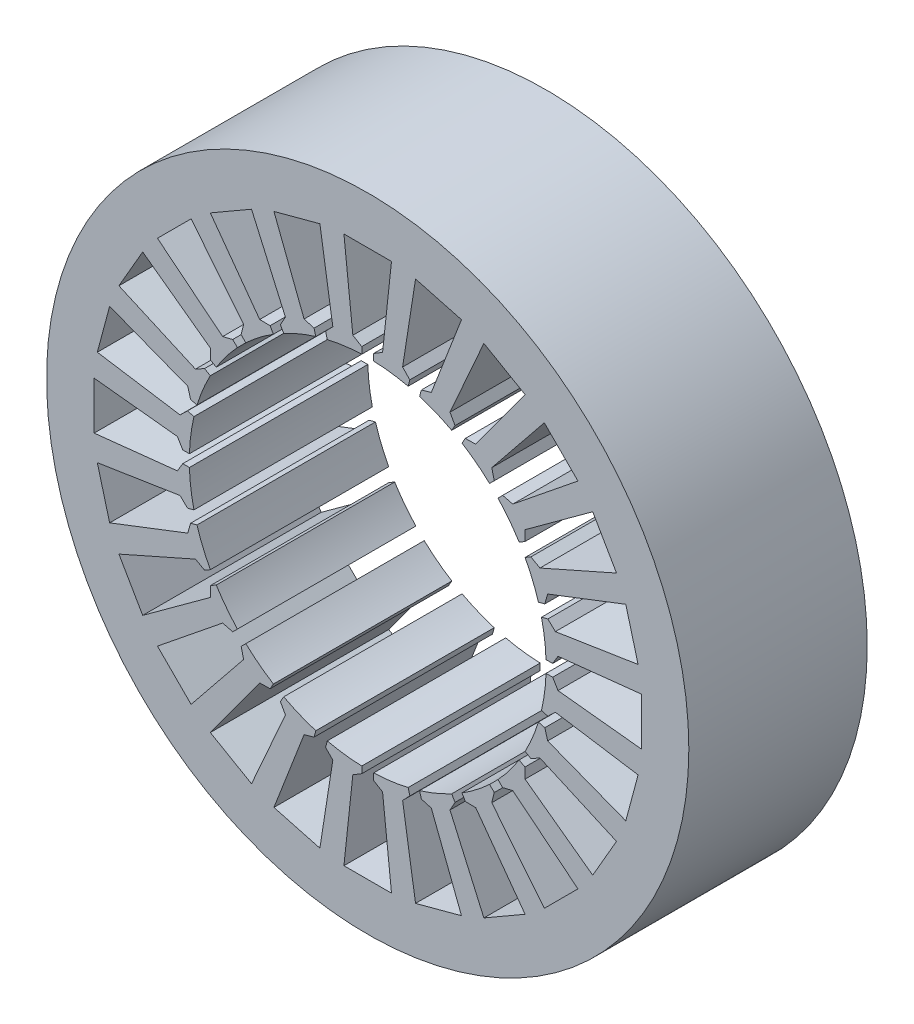
from build123d import *

# Parameters (mm, degrees)
STATOR_STACK_START = -15
SKETCH_1_R         = 54
SKETCH_1_R_2       = 30
STATOR_STACK_DEPTH = 30
STATOR_SLOTS_DEPTH = 16


with BuildPart() as part:
    # Эскиз1 → Stator_stack (new body)
    with BuildSketch(Plane.XY.offset(STATOR_STACK_START)):
        Circle(SKETCH_1_R)
        Circle(SKETCH_1_R_2, mode=Mode.SUBTRACT)
    extrude(amount=STATOR_STACK_DEPTH)

    # Эскиз2 → Stator_slots (cut, symmetric)
    with BuildSketch(Plane.XY):
        Polygon((28.982753492, -1), (31.1, -1), (32, -2.5), (39.5, -3.303571429), (46, -4), (46, 4), (39.5, 3.303571429), (32, 2.5), (31.1, 1), (28.982753492, 1), align=None)
        Polygon((28.25400916, 6.535362757), (30.299112243, 7.083346476), (31.556674054, 5.867394878), (39.009097341, 7.03234732), (45.46786419, 8.04197277), (43.397311829, 15.76937938), (37.299042936, 13.414357243), (30.262578828, 10.697024009), (29.781474152, 9.015198129), (27.73637107, 8.46721441), align=None)
        Polygon((25.599800796, 13.625351342), (27.433390058, 14.683974596), (28.962812921, 13.834936491), (35.859789164, 16.88902322), (41.837168574, 19.535898385), (37.837168574, 26.464101615), (32.556217735, 22.61097678), (26.462812921, 18.165063509), (26.433390058, 16.416025404), (24.599800796, 15.35740215), align=None)
        Polygon((21.201008313, 19.786794751), (22.698127676, 21.283914114), (24.395183951, 20.859650045), (30.266695616, 25.594740098), (35.355339059, 29.69848481), (29.69848481, 35.355339059), (25.594740098, 30.266695616), (20.859650045, 24.395183951), (21.283914114, 22.698127676), (19.786794751, 21.201008313), align=None)
        Polygon((15.35740215, 24.599800796), (16.416025404, 26.433390058), (18.165063509, 26.462812921), (22.61097678, 32.556217735), (26.464101615, 37.837168574), (19.535898385, 41.837168574), (16.88902322, 35.859789164), (13.834936491, 28.962812921), (14.683974596, 27.433390058), (13.625351342, 25.599800796), align=None)
        Polygon((8.46721441, 27.73637107), (9.015198129, 29.781474152), (10.697024009, 30.262578828), (13.414357243, 37.299042936), (15.76937938, 43.397311829), (8.04197277, 45.46786419), (7.03234732, 39.009097341), (5.867394878, 31.556674054), (7.083346476, 30.299112243), (6.535362757, 28.25400916), align=None)
        Polygon((1, 28.982753492), (1, 31.1), (2.5, 32), (3.303571429, 39.5), (4, 46), (-4, 46), (-3.303571429, 39.5), (-2.5, 32), (-1, 31.1), (-1, 28.982753492), align=None)
        Polygon((-6.535362757, 28.25400916), (-7.083346476, 30.299112243), (-5.867394878, 31.556674054), (-7.03234732, 39.009097341), (-8.04197277, 45.46786419), (-15.76937938, 43.397311829), (-13.414357243, 37.299042936), (-10.697024009, 30.262578828), (-9.015198129, 29.781474152), (-8.46721441, 27.73637107), align=None)
        Polygon((-13.625351342, 25.599800796), (-14.683974596, 27.433390058), (-13.834936491, 28.962812921), (-16.88902322, 35.859789164), (-19.535898385, 41.837168574), (-26.464101615, 37.837168574), (-22.61097678, 32.556217735), (-18.165063509, 26.462812921), (-16.416025404, 26.433390058), (-15.35740215, 24.599800796), align=None)
        Polygon((-19.786794751, 21.201008313), (-21.283914114, 22.698127676), (-20.859650045, 24.395183951), (-25.594740098, 30.266695616), (-29.69848481, 35.355339059), (-35.355339059, 29.69848481), (-30.266695616, 25.594740098), (-24.395183951, 20.859650045), (-22.698127676, 21.283914114), (-21.201008313, 19.786794751), align=None)
        Polygon((-24.599800796, 15.35740215), (-26.433390058, 16.416025404), (-26.462812921, 18.165063509), (-32.556217735, 22.61097678), (-37.837168574, 26.464101615), (-41.837168574, 19.535898385), (-35.859789164, 16.88902322), (-28.962812921, 13.834936491), (-27.433390058, 14.683974596), (-25.599800796, 13.625351342), align=None)
        Polygon((-27.73637107, 8.46721441), (-29.781474152, 9.015198129), (-30.262578828, 10.697024009), (-37.299042936, 13.414357243), (-43.397311829, 15.76937938), (-45.46786419, 8.04197277), (-39.009097341, 7.03234732), (-31.556674054, 5.867394878), (-30.299112243, 7.083346476), (-28.25400916, 6.535362757), align=None)
        Polygon((-28.982753492, 1), (-31.1, 1), (-32, 2.5), (-39.5, 3.303571429), (-46, 4), (-46, -4), (-39.5, -3.303571429), (-32, -2.5), (-31.1, -1), (-28.982753492, -1), align=None)
        Polygon((-28.25400916, -6.535362757), (-30.299112243, -7.083346476), (-31.556674054, -5.867394878), (-39.009097341, -7.03234732), (-45.46786419, -8.04197277), (-43.397311829, -15.76937938), (-37.299042936, -13.414357243), (-30.262578828, -10.697024009), (-29.781474152, -9.015198129), (-27.73637107, -8.46721441), align=None)
        Polygon((-25.599800796, -13.625351342), (-27.433390058, -14.683974596), (-28.962812921, -13.834936491), (-35.859789164, -16.88902322), (-41.837168574, -19.535898385), (-37.837168574, -26.464101615), (-32.556217735, -22.61097678), (-26.462812921, -18.165063509), (-26.433390058, -16.416025404), (-24.599800796, -15.35740215), align=None)
        Polygon((-21.201008313, -19.786794751), (-22.698127676, -21.283914114), (-24.395183951, -20.859650045), (-30.266695616, -25.594740098), (-35.355339059, -29.69848481), (-29.69848481, -35.355339059), (-25.594740098, -30.266695616), (-20.859650045, -24.395183951), (-21.283914114, -22.698127676), (-19.786794751, -21.201008313), align=None)
        Polygon((-15.35740215, -24.599800796), (-16.416025404, -26.433390058), (-18.165063509, -26.462812921), (-22.61097678, -32.556217735), (-26.464101615, -37.837168574), (-19.535898385, -41.837168574), (-16.88902322, -35.859789164), (-13.834936491, -28.962812921), (-14.683974596, -27.433390058), (-13.625351342, -25.599800796), align=None)
        Polygon((-8.46721441, -27.73637107), (-9.015198129, -29.781474152), (-10.697024009, -30.262578828), (-13.414357243, -37.299042936), (-15.76937938, -43.397311829), (-8.04197277, -45.46786419), (-7.03234732, -39.009097341), (-5.867394878, -31.556674054), (-7.083346476, -30.299112243), (-6.535362757, -28.25400916), align=None)
        Polygon((-1, -28.982753492), (-1, -31.1), (-2.5, -32), (-3.303571429, -39.5), (-4, -46), (4, -46), (3.303571429, -39.5), (2.5, -32), (1, -31.1), (1, -28.982753492), align=None)
        Polygon((6.535362757, -28.25400916), (7.083346476, -30.299112243), (5.867394878, -31.556674054), (7.03234732, -39.009097341), (8.04197277, -45.46786419), (15.76937938, -43.397311829), (13.414357243, -37.299042936), (10.697024009, -30.262578828), (9.015198129, -29.781474152), (8.46721441, -27.73637107), align=None)
        Polygon((13.625351342, -25.599800796), (14.683974596, -27.433390058), (13.834936491, -28.962812921), (16.88902322, -35.859789164), (19.535898385, -41.837168574), (26.464101615, -37.837168574), (22.61097678, -32.556217735), (18.165063509, -26.462812921), (16.416025404, -26.433390058), (15.35740215, -24.599800796), align=None)
        Polygon((19.786794751, -21.201008313), (21.283914114, -22.698127676), (20.859650045, -24.395183951), (25.594740098, -30.266695616), (29.69848481, -35.355339059), (35.355339059, -29.69848481), (30.266695616, -25.594740098), (24.395183951, -20.859650045), (22.698127676, -21.283914114), (21.201008313, -19.786794751), align=None)
        Polygon((24.599800796, -15.35740215), (26.433390058, -16.416025404), (26.462812921, -18.165063509), (32.556217735, -22.61097678), (37.837168574, -26.464101615), (41.837168574, -19.535898385), (35.859789164, -16.88902322), (28.962812921, -13.834936491), (27.433390058, -14.683974596), (25.599800796, -13.625351342), align=None)
        Polygon((27.73637107, -8.46721441), (29.781474152, -9.015198129), (30.262578828, -10.697024009), (37.299042936, -13.414357243), (43.397311829, -15.76937938), (45.46786419, -8.04197277), (39.009097341, -7.03234732), (31.556674054, -5.867394878), (30.299112243, -7.083346476), (28.25400916, -6.535362757), align=None)
    extrude(amount=STATOR_SLOTS_DEPTH, both=True, mode=Mode.SUBTRACT)


solid = part.part
